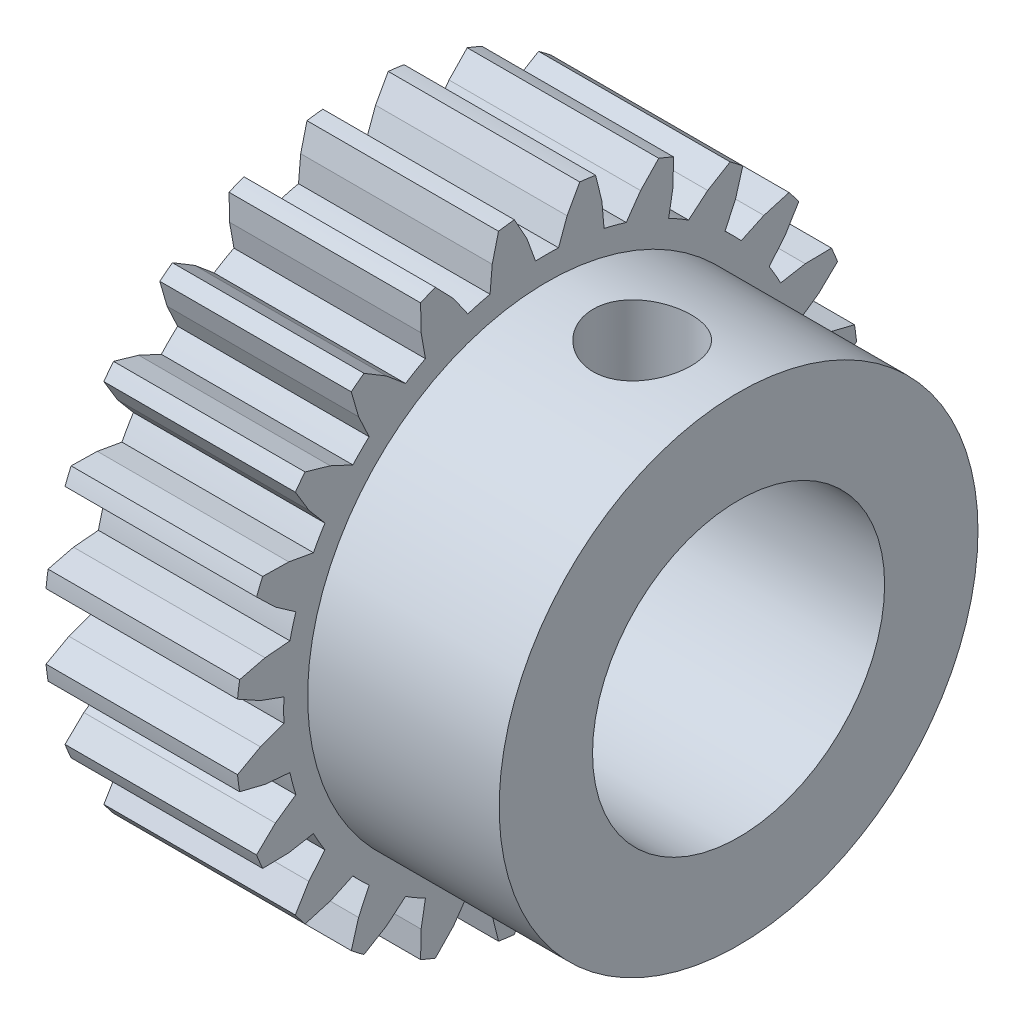
from build123d import *

# Parameters (mm, degrees)
BOSS_EXTRUDE1_DEPTH        = 4
SKETCH2_W                  = 4
SKETCH2_H                  = 5
F_6_1_6_1_DIAMETER_HOLE1_D = 6.1
SKETCH5_W                  = 1.025
SKETCH5_H                  = 10


with BuildPart() as part:
    # Sketch1 → Boss-Extrude1 (new body)
    with BuildSketch(Plane(origin=(2, 0, 0), x_dir=(0, 0, -1), z_dir=(1, 0, 0))):
        with BuildLine():
            Line((-5.494765219, -0.239906631), (-5.985388493, -0.418478899))
            Line((-5.985388493, -0.418478899), (-6.464027144, -0.682900491))
            ThreePointArc((-6.464027144, -0.682900491), (-6.444391599, -0.84842025), (-6.420518413, -1.013382112))
            Line((-6.420518413, -1.013382112), (-5.889751635, -1.144912958))
            Line((-5.889751635, -1.144912958), (-5.369628039, -1.190417877))
            ThreePointArc((-5.369628039, -1.190417877), (-5.312592045, -1.423504748), (-5.245443229, -1.653881897))
            Line((-5.245443229, -1.653881897), (-5.673131017, -1.95335211))
            Line((-5.673131017, -1.95335211), (-6.067023107, -2.332644554))
            ThreePointArc((-6.067023107, -2.332644554), (-6.005216961, -2.487442311), (-5.939461963, -2.640604399))
            Line((-5.939461963, -2.640604399), (-5.392737936, -2.630280889))
            Line((-5.392737936, -2.630280889), (-4.878559582, -2.539617373))
            ThreePointArc((-4.878559582, -2.539617373), (-4.763139721, -2.750000001), (-4.638652952, -2.955147847))
            Line((-4.638652952, -2.955147847), (-4.974259037, -3.355107604))
            Line((-4.974259037, -3.355107604), (-5.256561472, -3.823422746))
            ThreePointArc((-5.256561472, -3.823422746), (-5.156796712, -3.956949288), (-5.053640997, -4.087873858))
            Line((-5.053640997, -4.087873858), (-4.528218058, -3.936399524))
            Line((-4.528218058, -3.936399524), (-4.055025352, -3.715746142))
            ThreePointArc((-4.055025352, -3.715746142), (-3.889087296, -3.889087297), (-3.715746141, -4.055025353))
            Line((-3.715746141, -4.055025353), (-3.936399524, -4.528218058))
            Line((-3.936399524, -4.528218058), (-4.087873859, -5.053640996))
            ThreePointArc((-4.087873859, -5.053640996), (-3.956949289, -5.156796712), (-3.823422746, -5.256561471))
            Line((-3.823422746, -5.256561471), (-3.355107604, -4.974259037))
            Line((-3.355107604, -4.974259037), (-2.955147846, -4.638652952))
            ThreePointArc((-2.955147846, -4.638652952), (-2.75, -4.763139721), (-2.539617374, -4.878559582))
            Line((-2.539617374, -4.878559582), (-2.630280889, -5.392737936))
            Line((-2.630280889, -5.392737936), (-2.640604398, -5.939461963))
            ThreePointArc((-2.640604398, -5.939461963), (-2.48744231, -6.005216961), (-2.332644554, -6.067023107))
            Line((-2.332644554, -6.067023107), (-1.95335211, -5.673131017))
            Line((-1.95335211, -5.673131017), (-1.653881897, -5.245443229))
            ThreePointArc((-1.653881897, -5.245443229), (-1.423504748, -5.312592045), (-1.190417877, -5.369628039))
            Line((-1.190417877, -5.369628039), (-1.144912958, -5.889751635))
            Line((-1.144912958, -5.889751635), (-1.013382112, -6.420518413))
            ThreePointArc((-1.013382112, -6.420518413), (-0.848420249, -6.444391599), (-0.682900491, -6.464027144))
            Line((-0.682900491, -6.464027144), (-0.418478899, -5.985388493))
            Line((-0.418478899, -5.985388493), (-0.239906631, -5.494765219))
            ThreePointArc((-0.239906631, -5.494765219), (0, -5.5), (0.239906631, -5.494765219))
            Line((0.239906631, -5.494765219), (0.418478899, -5.985388493))
            Line((0.418478899, -5.985388493), (0.682900491, -6.464027144))
            ThreePointArc((0.682900491, -6.464027144), (0.84842025, -6.444391599), (1.013382113, -6.420518413))
            Line((1.013382113, -6.420518413), (1.144912958, -5.889751635))
            Line((1.144912958, -5.889751635), (1.190417877, -5.369628039))
            ThreePointArc((1.190417877, -5.369628039), (1.423504749, -5.312592045), (1.653881898, -5.245443229))
            Line((1.653881898, -5.245443229), (1.95335211, -5.673131017))
            Line((1.95335211, -5.673131017), (2.332644554, -6.067023107))
            ThreePointArc((2.332644554, -6.067023107), (2.48744231, -6.005216962), (2.640604397, -5.939461964))
            Line((2.640604397, -5.939461964), (2.630280889, -5.392737936))
            Line((2.630280889, -5.392737936), (2.539617373, -4.878559582))
            ThreePointArc((2.539617373, -4.878559582), (2.750000001, -4.76313972), (2.955147847, -4.638652951))
            Line((2.955147847, -4.638652951), (3.355107604, -4.974259037))
            Line((3.355107604, -4.974259037), (3.823422746, -5.256561472))
            ThreePointArc((3.823422746, -5.256561472), (3.956949288, -5.156796712), (4.087873858, -5.053640996))
            Line((4.087873858, -5.053640996), (3.936399524, -4.528218058))
            Line((3.936399524, -4.528218058), (3.715746142, -4.055025352))
            ThreePointArc((3.715746142, -4.055025352), (3.889087296, -3.889087297), (4.055025352, -3.715746143))
            Line((4.055025352, -3.715746143), (4.528218058, -3.936399524))
            Line((4.528218058, -3.936399524), (5.053640996, -4.087873859))
            ThreePointArc((5.053640996, -4.087873859), (5.156796712, -3.956949289), (5.256561472, -3.823422746))
            Line((5.256561472, -3.823422746), (4.974259037, -3.355107604))
            Line((4.974259037, -3.355107604), (4.638652952, -2.955147846))
            ThreePointArc((4.638652952, -2.955147846), (4.763139721, -2.75), (4.878559582, -2.539617373))
            Line((4.878559582, -2.539617373), (5.392737936, -2.630280889))
            Line((5.392737936, -2.630280889), (5.939461963, -2.640604398))
            ThreePointArc((5.939461963, -2.640604398), (6.005216962, -2.48744231), (6.067023108, -2.332644554))
            Line((6.067023108, -2.332644554), (5.673131017, -1.95335211))
            Line((5.673131017, -1.95335211), (5.245443229, -1.653881897))
            ThreePointArc((5.245443229, -1.653881897), (5.312592045, -1.423504748), (5.369628039, -1.190417877))
            Line((5.369628039, -1.190417877), (5.889751635, -1.144912958))
            Line((5.889751635, -1.144912958), (6.420518413, -1.013382112))
            ThreePointArc((6.420518413, -1.013382112), (6.444391599, -0.848420249), (6.464027144, -0.68290049))
            Line((6.464027144, -0.68290049), (5.985388493, -0.418478899))
            Line((5.985388493, -0.418478899), (5.494765219, -0.239906631))
            ThreePointArc((5.494765219, -0.239906631), (5.5, 0), (5.494765219, 0.239906631))
            Line((5.494765219, 0.239906631), (5.985388493, 0.418478899))
            Line((5.985388493, 0.418478899), (6.464027144, 0.682900491))
            ThreePointArc((6.464027144, 0.682900491), (6.444391599, 0.848420249), (6.420518413, 1.013382112))
            Line((6.420518413, 1.013382112), (5.889751635, 1.144912958))
            Line((5.889751635, 1.144912958), (5.369628039, 1.190417877))
            ThreePointArc((5.369628039, 1.190417877), (5.312592045, 1.423504748), (5.245443229, 1.653881897))
            Line((5.245443229, 1.653881897), (5.673131017, 1.95335211))
            Line((5.673131017, 1.95335211), (6.067023107, 2.332644554))
            ThreePointArc((6.067023107, 2.332644554), (6.005216961, 2.48744231), (5.939461963, 2.640604398))
            Line((5.939461963, 2.640604398), (5.392737936, 2.630280889))
            Line((5.392737936, 2.630280889), (4.878559582, 2.539617374))
            ThreePointArc((4.878559582, 2.539617374), (4.763139721, 2.75), (4.638652952, 2.955147846))
            Line((4.638652952, 2.955147846), (4.974259037, 3.355107604))
            Line((4.974259037, 3.355107604), (5.256561472, 3.823422746))
            ThreePointArc((5.256561472, 3.823422746), (5.156796712, 3.956949289), (5.053640996, 4.087873859))
            Line((5.053640996, 4.087873859), (4.528218058, 3.936399524))
            Line((4.528218058, 3.936399524), (4.055025352, 3.715746143))
            ThreePointArc((4.055025352, 3.715746143), (3.889087296, 3.889087297), (3.715746142, 4.055025352))
            Line((3.715746142, 4.055025352), (3.936399524, 4.528218058))
            Line((3.936399524, 4.528218058), (4.087873858, 5.053640997))
            ThreePointArc((4.087873858, 5.053640997), (3.956949288, 5.156796712), (3.823422746, 5.256561472))
            Line((3.823422746, 5.256561472), (3.355107604, 4.974259037))
            Line((3.355107604, 4.974259037), (2.955147847, 4.638652952))
            ThreePointArc((2.955147847, 4.638652952), (2.750000001, 4.763139721), (2.539617373, 4.878559582))
            Line((2.539617373, 4.878559582), (2.630280889, 5.392737936))
            Line((2.630280889, 5.392737936), (2.640604399, 5.939461963))
            ThreePointArc((2.640604399, 5.939461963), (2.487442311, 6.005216961), (2.332644554, 6.067023107))
            Line((2.332644554, 6.067023107), (1.95335211, 5.673131017))
            Line((1.95335211, 5.673131017), (1.653881898, 5.245443229))
            ThreePointArc((1.653881898, 5.245443229), (1.423504748, 5.312592045), (1.190417877, 5.369628039))
            Line((1.190417877, 5.369628039), (1.144912958, 5.889751635))
            Line((1.144912958, 5.889751635), (1.013382112, 6.420518413))
            ThreePointArc((1.013382112, 6.420518413), (0.84842025, 6.444391599), (0.682900491, 6.464027144))
            Line((0.682900491, 6.464027144), (0.418478899, 5.985388493))
            Line((0.418478899, 5.985388493), (0.239906631, 5.494765219))
            ThreePointArc((0.239906631, 5.494765219), (0, 5.5), (-0.239906631, 5.494765219))
            Line((-0.239906631, 5.494765219), (-0.418478899, 5.985388493))
            Line((-0.418478899, 5.985388493), (-0.682900491, 6.464027144))
            ThreePointArc((-0.682900491, 6.464027144), (-0.84842025, 6.444391599), (-1.013382112, 6.420518413))
            Line((-1.013382112, 6.420518413), (-1.144912958, 5.889751635))
            Line((-1.144912958, 5.889751635), (-1.190417878, 5.369628039))
            ThreePointArc((-1.190417878, 5.369628039), (-1.423504748, 5.312592045), (-1.653881897, 5.245443229))
            Line((-1.653881897, 5.245443229), (-1.95335211, 5.673131017))
            Line((-1.95335211, 5.673131017), (-2.332644555, 6.067023107))
            ThreePointArc((-2.332644555, 6.067023107), (-2.487442311, 6.005216961), (-2.640604398, 5.939461963))
            Line((-2.640604398, 5.939461963), (-2.630280889, 5.392737936))
            Line((-2.630280889, 5.392737936), (-2.539617374, 4.878559582))
            ThreePointArc((-2.539617374, 4.878559582), (-2.750000001, 4.76313972), (-2.955147846, 4.638652952))
            Line((-2.955147846, 4.638652952), (-3.355107604, 4.974259037))
            Line((-3.355107604, 4.974259037), (-3.823422747, 5.256561471))
            ThreePointArc((-3.823422747, 5.256561471), (-3.956949289, 5.156796712), (-4.087873859, 5.053640996))
            Line((-4.087873859, 5.053640996), (-3.936399524, 4.528218058))
            Line((-3.936399524, 4.528218058), (-3.715746141, 4.055025353))
            ThreePointArc((-3.715746141, 4.055025353), (-3.889087296, 3.889087297), (-4.055025352, 3.715746142))
            Line((-4.055025352, 3.715746142), (-4.528218058, 3.936399524))
            Line((-4.528218058, 3.936399524), (-5.053640995, 4.08787386))
            ThreePointArc((-5.053640995, 4.08787386), (-5.156796711, 3.956949289), (-5.256561472, 3.823422746))
            Line((-5.256561472, 3.823422746), (-4.974259037, 3.355107604))
            Line((-4.974259037, 3.355107604), (-4.638652952, 2.955147846))
            ThreePointArc((-4.638652952, 2.955147846), (-4.763139721, 2.75), (-4.878559582, 2.539617373))
            Line((-4.878559582, 2.539617373), (-5.392737936, 2.630280889))
            Line((-5.392737936, 2.630280889), (-5.939461963, 2.640604399))
            ThreePointArc((-5.939461963, 2.640604399), (-6.005216961, 2.487442311), (-6.067023107, 2.332644554))
            Line((-6.067023107, 2.332644554), (-5.673131017, 1.95335211))
            Line((-5.673131017, 1.95335211), (-5.245443229, 1.653881897))
            ThreePointArc((-5.245443229, 1.653881897), (-5.312592045, 1.423504748), (-5.369628039, 1.190417877))
            Line((-5.369628039, 1.190417877), (-5.889751635, 1.144912958))
            Line((-5.889751635, 1.144912958), (-6.420518413, 1.013382112))
            ThreePointArc((-6.420518413, 1.013382112), (-6.444391599, 0.848420249), (-6.464027144, 0.682900491))
            Line((-6.464027144, 0.682900491), (-5.985388493, 0.418478899))
            Line((-5.985388493, 0.418478899), (-5.494765219, 0.23990663))
            ThreePointArc((-5.494765219, 0.23990663), (-5.5, -1e-09), (-5.494765219, -0.239906631))
        make_face()
    extrude(amount=-BOSS_EXTRUDE1_DEPTH)

    # Sketch2 → Revolve1 (revolve)
    with BuildSketch(Plane.XY, mode=Mode.PRIVATE) as revolve1_sk:
        with Locations((4, 2.5)):
            Rectangle(SKETCH2_W, SKETCH2_H)
    revolve(revolve1_sk.sketch.rotate(Axis((2, 0, 0), (1, 0, 0)), 270), axis=Axis((2, 0, 0), (1, 0, 0)))

    # Ø6.1 (6.1) Diameter Hole1 (through all)
    with Locations(Plane(origin=(6, 0, 0), x_dir=(0, 0, -1), z_dir=(1, 0, 0))):
        with Locations((0, 0)):
            Hole(F_6_1_6_1_DIAMETER_HOLE1_D / 2)

    # Sketch5 → Ø2.05 (2.05) Diameter Hole1 (revolve, cut)
    with BuildSketch(Plane(origin=(4, 2.87259786, 0.007519122), x_dir=(0, 0.0026175250609996566, -0.9999965742754098), z_dir=(1, 0, 0))):
        with Locations((0.5125, 5)):
            Rectangle(SKETCH5_W, SKETCH5_H)
    revolve(axis=Axis((4, -3.477380387, -0.009102162), (0, 0.9999965742754098, 0.0026175250609996566)), mode=Mode.SUBTRACT)


solid = part.part
